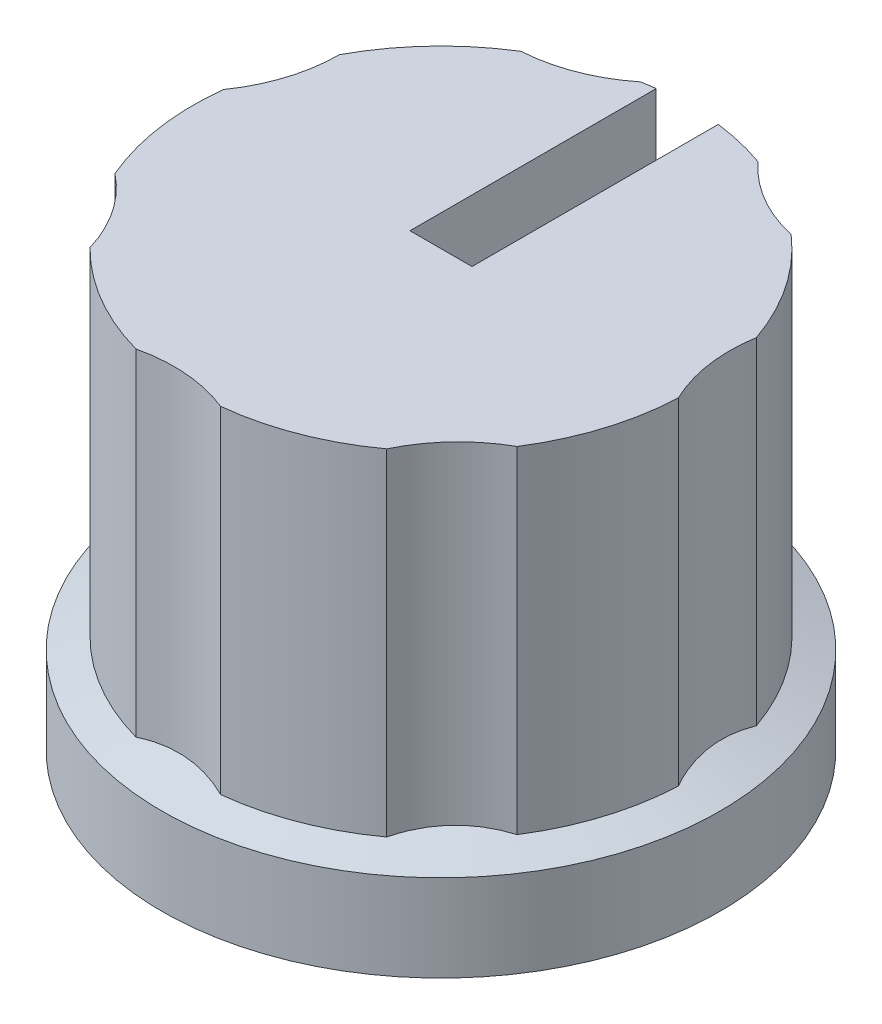
from build123d import *

# Parameters (mm, degrees)
SKETCH1_R           = 5.715
BOSS_EXTRUDE1_DEPTH = 1.778
BOSS_EXTRUDE3_DEPTH = 8.89
SKETCH6_W           = 1.27
SKETCH6_H           = 14.319161929
CUT_EXTRUDE4_DEPTH  = 13.014764004
SKETCH9_R           = 3.429
CUT_EXTRUDE6_DEPTH  = 7.62


with BuildPart() as part:
    # Sketch1 → Boss-Extrude1 (new body)
    with BuildSketch(Plane(origin=(0, 0, 0), x_dir=(1, 0, 0), z_dir=(0, 1, 0))):
        with Locations(Location((0, 0, 0), (0, 0, 270))):
            Circle(SKETCH1_R)
    extrude(amount=BOSS_EXTRUDE1_DEPTH)

    # Boss-Extrude2 cone 1 section (through the dimple's axis) → Boss-Extrude2 (revolve)
    with BuildSketch(Plane(origin=(0, 1.778, 0), x_dir=(0, 0, -1), z_dir=(1, 0, 0))):
        Polygon((0, 0), (5.715, 0), (0, 2.080089889), align=None)
    revolve(axis=Axis((0, 1.778, 0), (0, 1, 0)))

    # Sketch5 → Boss-Extrude3 (add)
    with BuildSketch(Plane.XZ):
        with BuildLine():
            ThreePointArc((3.334987409, -3.832004565), (2.446327806, -4.183135508), (1.704579152, -4.785479068))
            ThreePointArc((1.704579152, -4.785479068), (0.407862853, -5.06360029), (-0.916651171, -4.996613917))
            ThreePointArc((-0.916651171, -4.996613917), (-1.745246597, -4.520758424), (-2.678650476, -4.316391042))
            ThreePointArc((-2.678650476, -4.316391042), (-3.704583791, -3.475983161), (-4.478032723, -2.398671077))
            ThreePointArc((-4.478032723, -2.398671077), (-4.622614715, -1.45415804), (-5.044801662, -0.596972523))
            ThreePointArc((-5.044801662, -0.596972523), (-5.027403282, 0.729120186), (-4.667364299, 2.005520007))
            ThreePointArc((-4.667364299, 2.005520007), (-4.019059669, 2.707453007), (-3.612114301, 3.571978482))
            ThreePointArc((-3.612114301, 3.571978482), (-2.56448556, 4.385181161), (-1.342075361, 4.899513621))
            ThreePointArc((-1.342075361, 4.899513621), (-0.389070718, 4.830296718), (0.540568802, 5.051156835))
            ThreePointArc((0.540568802, 5.051156835), (1.829542094, 4.73911128), (2.993823697, 4.104073546))
            ThreePointArc((2.993823697, 4.104073546), (3.533896419, 3.31582848), (4.286192572, 2.726711066))
            ThreePointArc((4.286192572, 2.726711066), (4.845887235, 1.524393946), (5.075312448, 0.218182383))
            ThreePointArc((5.075312448, 0.218182383), (4.795767474, -0.695526234), (4.804225912, -1.65100375))
            ThreePointArc((4.804225912, -1.65100375), (4.213180451, -2.838223122), (3.334987409, -3.832004565))
        make_face()
    extrude(amount=-BOSS_EXTRUDE3_DEPTH)

    # Sketch6 → Cut-Extrude4 (cut, through all)
    with BuildSketch(Plane(origin=(0, 0, 0), x_dir=(-1, 0, 0), z_dir=(0, -1, 0))):
        with Locations((0, 7.159580965)):
            Rectangle(SKETCH6_W, SKETCH6_H)
    extrude(amount=-CUT_EXTRUDE4_DEPTH, mode=Mode.SUBTRACT)

    # Sketch9 → Cut-Extrude6 (cut)
    with BuildSketch(Plane.XZ):
        Circle(SKETCH9_R)
    extrude(amount=-CUT_EXTRUDE6_DEPTH, mode=Mode.SUBTRACT)


solid = part.part
